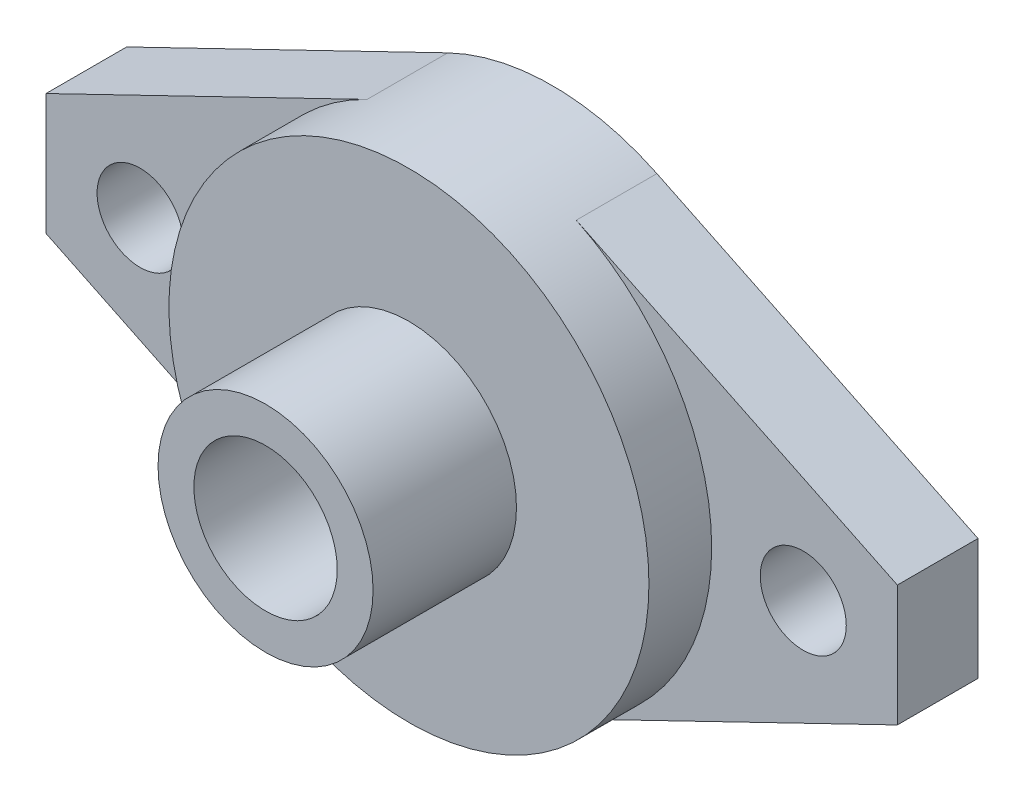
from build123d import *

# Parameters (mm, degrees)
SKETCH_1_R        = 2.4
EXTRUDE_1_DEPTH   = 4.5
EXTRUDE_1_2_DEPTH = 4.5
SKETCH_1_3_R      = 13.391071773
SKETCH_1_3_R_2    = 6
EXTRUDE_2_DEPTH   = 8
SKETCH_1_4_R      = 6
SKETCH_1_4_R_2    = 4
EXTRUDE_3_DEPTH   = 16


with BuildPart() as part:
    # 草图1 → 凸台-拉伸1 (new body)
    with BuildSketch(Plane.XY):
        with BuildLine():
            Line((5.83466248, -12.053112336), (23.75, -3.380667253))
            Line((23.75, -3.380667253), (23.75, 3.380667253))
            Line((23.75, 3.380667253), (5.834662804, 12.053112179))
            ThreePointArc((5.834662804, 12.053112179), (13.391071773, -1.8e-07), (5.83466248, -12.053112336))
        make_face()
        with Locations((18.5, 0)):
            Circle(SKETCH_1_R, mode=Mode.SUBTRACT)
    extrude(amount=EXTRUDE_1_DEPTH)



with BuildPart() as body_2:
    # 草图1 → Extrude 1 2 (new body)
    with BuildSketch(Plane.XY):
        with BuildLine():
            Line((-23.75, -3.380667253), (-5.834662541, -12.053112306))
            ThreePointArc((-5.834662541, -12.053112306), (-13.391071773, -1.46e-07), (-5.834662804, 12.053112179))
            Line((-5.834662804, 12.053112179), (-23.75, 3.380667253))
            Line((-23.75, 3.380667253), (-23.75, -3.380667253))
        make_face()
        with Locations((-18.5, 0)):
            Circle(SKETCH_1_R, mode=Mode.SUBTRACT)
    extrude(amount=EXTRUDE_1_2_DEPTH)


with BuildPart() as part_1:
    add(part.part)

    add(body_2.part)  # 凸台-拉伸2 merges body 2
    # 草图1<3> → 凸台-拉伸2 (add)
    with BuildSketch(Plane.XY):
        Circle(SKETCH_1_3_R)
        Circle(SKETCH_1_3_R_2, mode=Mode.SUBTRACT)
    extrude(amount=EXTRUDE_2_DEPTH)


with BuildPart() as body_2_2:
    # 草图1<4> → 凸台-拉伸3 (new body)
    with BuildSketch(Plane.XY):
        Circle(SKETCH_1_4_R)
        Circle(SKETCH_1_4_R_2, mode=Mode.SUBTRACT)
    extrude(amount=EXTRUDE_3_DEPTH)


solid = Compound([part_1.part, body_2_2.part])
